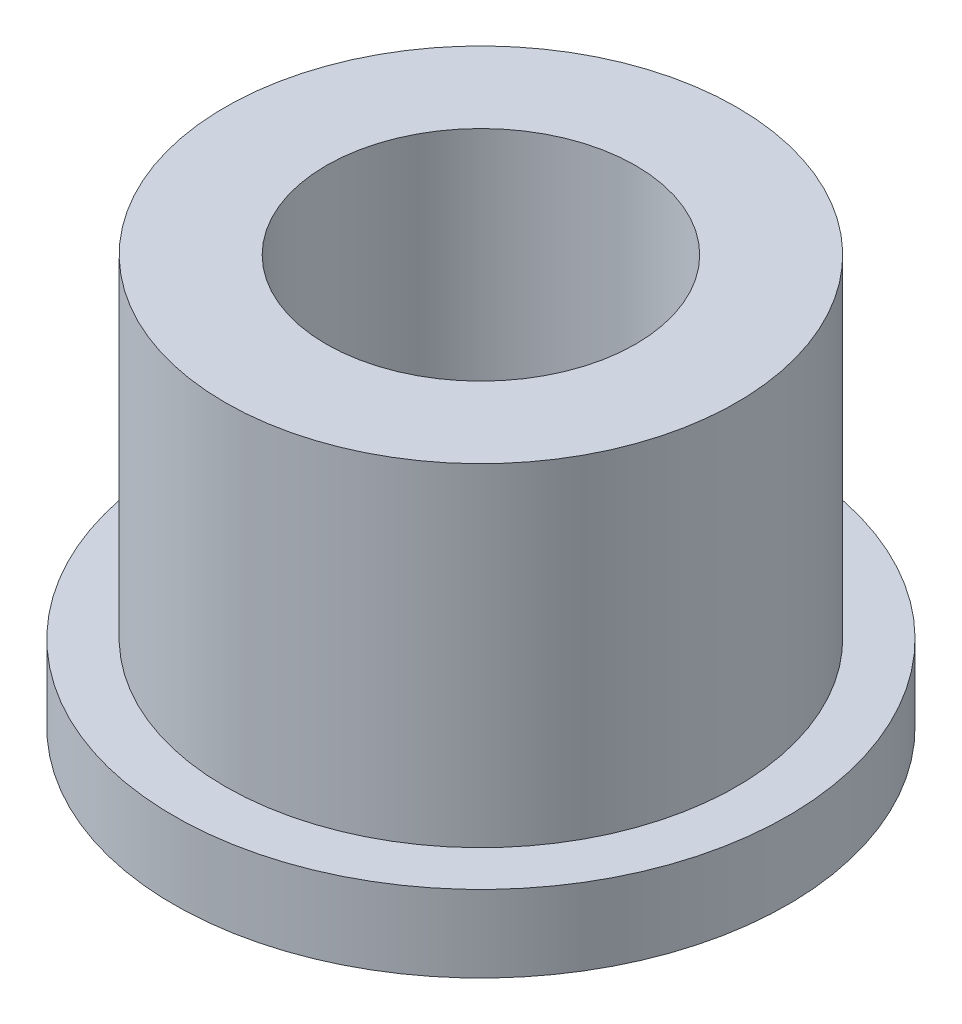
from build123d import *

# Parameters (mm, degrees)
SKETCH2_R           = 3.96875
SKETCH2_R_2         = 2.4003
BOSS_EXTRUDE1_DEPTH = 6.35
SKETCH3_R           = 4.7625
SKETCH3_R_2         = 3.96875
BOSS_EXTRUDE2_DEPTH = 1.190625


with BuildPart() as part:
    # Sketch2 → Boss-Extrude1 (new body)
    with BuildSketch(Plane(origin=(0, 0, 0), x_dir=(1, 0, 0), z_dir=(0, 1, 0))):
        with Locations(Location((0, 0, 0), (0, 0, 270))):
            Circle(SKETCH2_R)
        with Locations(Location((0, 0, 0), (0, 0, 270))):
            Circle(SKETCH2_R_2, mode=Mode.SUBTRACT)
    extrude(amount=BOSS_EXTRUDE1_DEPTH)

    # Sketch3 → Boss-Extrude2 (add)
    with BuildSketch(Plane(origin=(0, 0, 0), x_dir=(1, 0, 0), z_dir=(0, 1, 0))):
        with Locations(Location((0, 0, 0), (0, 0, 90))):
            Circle(SKETCH3_R)
        with Locations(Location((0, 0, 0), (0, 0, 270))):
            Circle(SKETCH3_R_2, mode=Mode.SUBTRACT)
    extrude(amount=BOSS_EXTRUDE2_DEPTH)


solid = part.part
